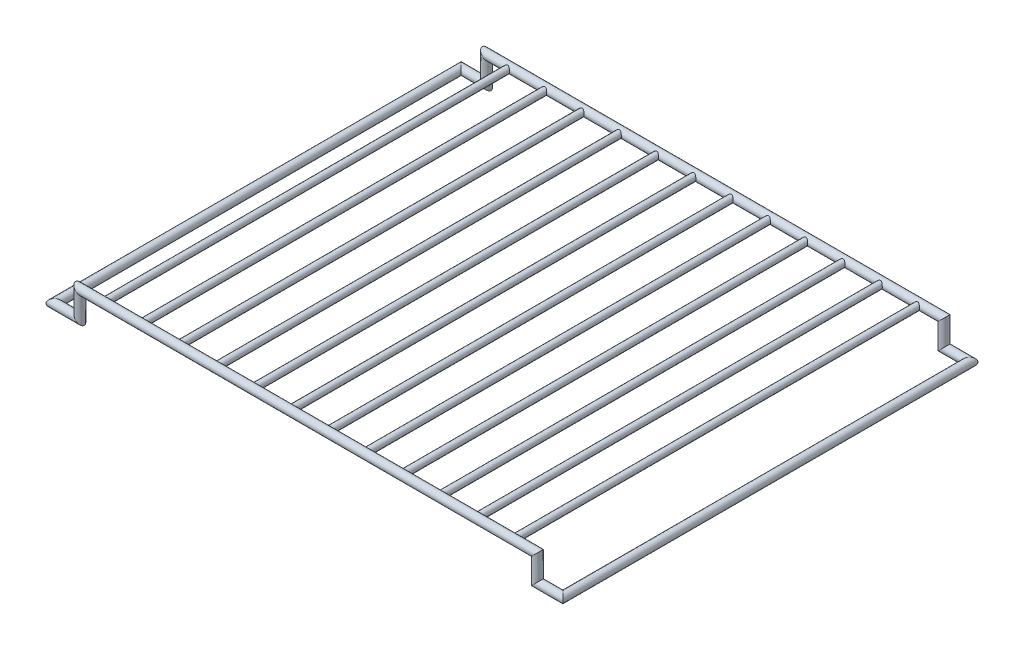
from build123d import *

# Parameters (mm, degrees)
SKETCH1_R                 = 2.5
BOSS_EXTRUDE1_REACH       = 289
BOSS_EXTRUDE1_END_RADIUS  = 2.5
SKETCH2_R                 = 2
LPATTERN1_COUNT           = 6
LPATTERN1_PITCH           = 22
MIRROR1_COPY_1_REACH      = 289
MIRROR1_COPY_1_END_RADIUS = 2.5
MIRROR1_COPY_1_SKETCH_R   = 2
MIRROR1_COPY_2_REACH      = 289
MIRROR1_COPY_2_END_RADIUS = 2.5
MIRROR1_COPY_2_SKETCH_R   = 2
MIRROR1_COPY_3_REACH      = 289
MIRROR1_COPY_3_END_RADIUS = 2.5
MIRROR1_COPY_3_SKETCH_R   = 2
MIRROR1_COPY_4_REACH      = 289
MIRROR1_COPY_4_END_RADIUS = 2.5
MIRROR1_COPY_4_SKETCH_R   = 2
MIRROR1_COPY_5_REACH      = 289
MIRROR1_COPY_5_END_RADIUS = 2.5
MIRROR1_COPY_5_SKETCH_R   = 2


with BuildPart() as part:
    # Sweep1: sweep along a curve in space
    with BuildLine() as sweep1_path:
        Line((0, 0, 0), (135, 0, 0))
        Line((135, 0, 0), (135, -15, 0))
        Line((135, -15, 0), (150, -15, 0))
        Line((150, -15, 0), (150, -15, -240))
        Line((150, -15, -240), (135, -15, -240))
        Line((135, -15, -240), (135, 0, -240))
        Line((135, 0, -240), (0, 0, -240))
    # Sketch1 → Sweep1 (sweep)
    with BuildSketch(Plane(origin=(0, 0, 0), x_dir=(0, 0, -1), z_dir=(1, 0, 0))):
        Circle(SKETCH1_R)
    sweep1 = sweep(path=sweep1_path.line, transition=Transition.RIGHT)

    # Boss-Extrude1: up to this cylinder (the profile starts outside it)
    boss_extrude1_end = Plane(origin=(11, 0, -240), z_dir=(-1, 0, 0)) * Cylinder(BOSS_EXTRUDE1_END_RADIUS, 584, mode=Mode.PRIVATE)
    # Sketch2 → Boss-Extrude1 (add, up to the surface)
    with BuildSketch(Plane.XY, mode=Mode.PRIVATE) as boss_extrude1_sk1:
        with Locations((11, 0)):
            Circle(SKETCH2_R)
    boss_extrude1_tool1 = extrude(boss_extrude1_sk1.sketch, amount=-BOSS_EXTRUDE1_REACH, mode=Mode.PRIVATE) - boss_extrude1_end
    boss_extrude1 = boss_extrude1_tool1.solids().sort_by_distance((11, 0, 0))[0]
    add(boss_extrude1)

    # LPattern1: Boss-Extrude1 ×6
    with Locations(*[(i * LPATTERN1_PITCH, 0, 0) for i in range(1, LPATTERN1_COUNT)]):
        add(boss_extrude1)

    # Mirror1: Sweep1, Boss-Extrude1 across plane
    add(sweep1.mirror(Plane(origin=(0, 0, 0), x_dir=(0, 0, 1), z_dir=(1, 0, 0))))
    add(boss_extrude1.mirror(Plane(origin=(0, 0, 0), x_dir=(0, 0, 1), z_dir=(1, 0, 0))))

    # Mirror1 copy 1: up to this cylinder (the profile starts outside it)
    mirror1_copy_1_end = Plane(origin=(11, 0, -240), z_dir=(-1, 0, 0)) * Cylinder(MIRROR1_COPY_1_END_RADIUS, 584, mode=Mode.PRIVATE)
    # Mirror1 copy 1 sketch → Mirror1 copy 1 (add, up to the surface)
    with BuildSketch(Plane(origin=(-22, 0, 0), x_dir=(-1, 0, 0), z_dir=(0, 0, 1)), mode=Mode.PRIVATE) as mirror1_copy_1_sk1:
        with Locations((11, 0)):
            Circle(MIRROR1_COPY_1_SKETCH_R)
    mirror1_copy_1_tool1 = extrude(mirror1_copy_1_sk1.sketch, amount=-MIRROR1_COPY_1_REACH, mode=Mode.PRIVATE) - mirror1_copy_1_end
    add(mirror1_copy_1_tool1.solids().sort_by_distance((11, 0, 0))[0])

    # Mirror1 copy 2: up to this cylinder (the profile starts outside it)
    mirror1_copy_2_end = Plane(origin=(11, 0, -240), z_dir=(-1, 0, 0)) * Cylinder(MIRROR1_COPY_2_END_RADIUS, 584, mode=Mode.PRIVATE)
    # Mirror1 copy 2 sketch → Mirror1 copy 2 (add, up to the surface)
    with BuildSketch(Plane(origin=(-44, 0, 0), x_dir=(-1, 0, 0), z_dir=(0, 0, 1)), mode=Mode.PRIVATE) as mirror1_copy_2_sk1:
        with Locations((11, 0)):
            Circle(MIRROR1_COPY_2_SKETCH_R)
    mirror1_copy_2_tool1 = extrude(mirror1_copy_2_sk1.sketch, amount=-MIRROR1_COPY_2_REACH, mode=Mode.PRIVATE) - mirror1_copy_2_end
    add(mirror1_copy_2_tool1.solids().sort_by_distance((11, 0, 0))[0])

    # Mirror1 copy 3: up to this cylinder (the profile starts outside it)
    mirror1_copy_3_end = Plane(origin=(11, 0, -240), z_dir=(-1, 0, 0)) * Cylinder(MIRROR1_COPY_3_END_RADIUS, 584, mode=Mode.PRIVATE)
    # Mirror1 copy 3 sketch → Mirror1 copy 3 (add, up to the surface)
    with BuildSketch(Plane(origin=(-66, 0, 0), x_dir=(-1, 0, 0), z_dir=(0, 0, 1)), mode=Mode.PRIVATE) as mirror1_copy_3_sk1:
        with Locations((11, 0)):
            Circle(MIRROR1_COPY_3_SKETCH_R)
    mirror1_copy_3_tool1 = extrude(mirror1_copy_3_sk1.sketch, amount=-MIRROR1_COPY_3_REACH, mode=Mode.PRIVATE) - mirror1_copy_3_end
    add(mirror1_copy_3_tool1.solids().sort_by_distance((11, 0, 0))[0])

    # Mirror1 copy 4: up to this cylinder (the profile starts outside it)
    mirror1_copy_4_end = Plane(origin=(11, 0, -240), z_dir=(-1, 0, 0)) * Cylinder(MIRROR1_COPY_4_END_RADIUS, 584, mode=Mode.PRIVATE)
    # Mirror1 copy 4 sketch → Mirror1 copy 4 (add, up to the surface)
    with BuildSketch(Plane(origin=(-88, 0, 0), x_dir=(-1, 0, 0), z_dir=(0, 0, 1)), mode=Mode.PRIVATE) as mirror1_copy_4_sk1:
        with Locations((11, 0)):
            Circle(MIRROR1_COPY_4_SKETCH_R)
    mirror1_copy_4_tool1 = extrude(mirror1_copy_4_sk1.sketch, amount=-MIRROR1_COPY_4_REACH, mode=Mode.PRIVATE) - mirror1_copy_4_end
    add(mirror1_copy_4_tool1.solids().sort_by_distance((11, 0, 0))[0])

    # Mirror1 copy 5: up to this cylinder (the profile starts outside it)
    mirror1_copy_5_end = Plane(origin=(11, 0, -240), z_dir=(-1, 0, 0)) * Cylinder(MIRROR1_COPY_5_END_RADIUS, 584, mode=Mode.PRIVATE)
    # Mirror1 copy 5 sketch → Mirror1 copy 5 (add, up to the surface)
    with BuildSketch(Plane(origin=(-110, 0, 0), x_dir=(-1, 0, 0), z_dir=(0, 0, 1)), mode=Mode.PRIVATE) as mirror1_copy_5_sk1:
        with Locations((11, 0)):
            Circle(MIRROR1_COPY_5_SKETCH_R)
    mirror1_copy_5_tool1 = extrude(mirror1_copy_5_sk1.sketch, amount=-MIRROR1_COPY_5_REACH, mode=Mode.PRIVATE) - mirror1_copy_5_end
    add(mirror1_copy_5_tool1.solids().sort_by_distance((11, 0, 0))[0])


solid = part.part
